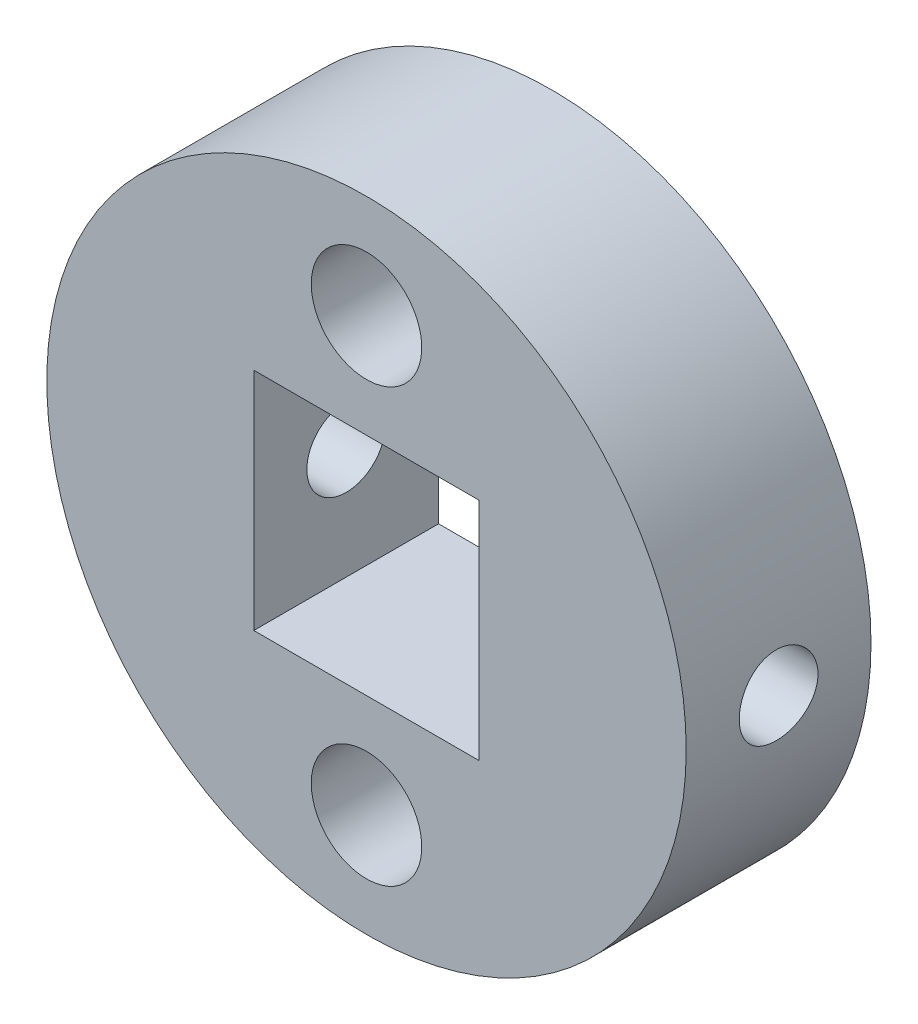
from build123d import *

# Parameters (mm, degrees)
SKETCH1_R                           = 10.9855
SKETCH1_W                           = 7.747
SKETCH1_H                           = 7.747
BOSS_EXTRUDE1_DEPTH                 = 6.35
F_6_32_TAPPED_HOLE1_D               = 2.7051
F_6_32_TAPPED_HOLE1_DEPTH           = 7.112
F_6_32_TAPPED_HOLE1_ON_FACE_2_D     = 2.7051
F_6_32_TAPPED_HOLE1_ON_FACE_2_DEPTH = 7.112
F_6_32_TAPPED_HOLE2_D               = 2.7051
F_6_CLEARANCE_HOLE1_D               = 3.7973


with BuildPart() as part:
    # Sketch1 → Boss-Extrude1 (new body)
    with BuildSketch(Plane.XY):
        Circle(SKETCH1_R)
        Rectangle(SKETCH1_W, SKETCH1_H, mode=Mode.SUBTRACT)
    extrude(amount=BOSS_EXTRUDE1_DEPTH)

    # #6-32 Tapped Hole1
    with Locations(Plane(origin=(10.9855, 0, 3.175), x_dir=(0, 0, 1), z_dir=(1, 0, 0))):
        with Locations((0, 0)):
            Hole(F_6_32_TAPPED_HOLE1_D / 2, depth=F_6_32_TAPPED_HOLE1_DEPTH)

    # #6-32 Tapped Hole1 on face 2
    with Locations(Plane(origin=(3.8735, 0, 3.175), x_dir=(0, 0, -1), z_dir=(-1, 0, 0))):
        with Locations((0, 0)):
            Hole(F_6_32_TAPPED_HOLE1_ON_FACE_2_D / 2, depth=F_6_32_TAPPED_HOLE1_ON_FACE_2_DEPTH)

    # #6-32 Tapped Hole2 (through all)
    with Locations(Plane(origin=(-3.8735, 0, 0), x_dir=(0, 0, -1), z_dir=(1, 0, 0))):
        with Locations((-3.175, 0)):
            Hole(F_6_32_TAPPED_HOLE2_D / 2)

    # #6 Clearance Hole1 (through all)
    with Locations(Plane(origin=(0, 0, 0), x_dir=(-1, 0, 0), z_dir=(0, 0, -1))):
        with Locations((0, -7.4295), (0, 7.4295)):
            Hole(F_6_CLEARANCE_HOLE1_D / 2)


solid = part.part
